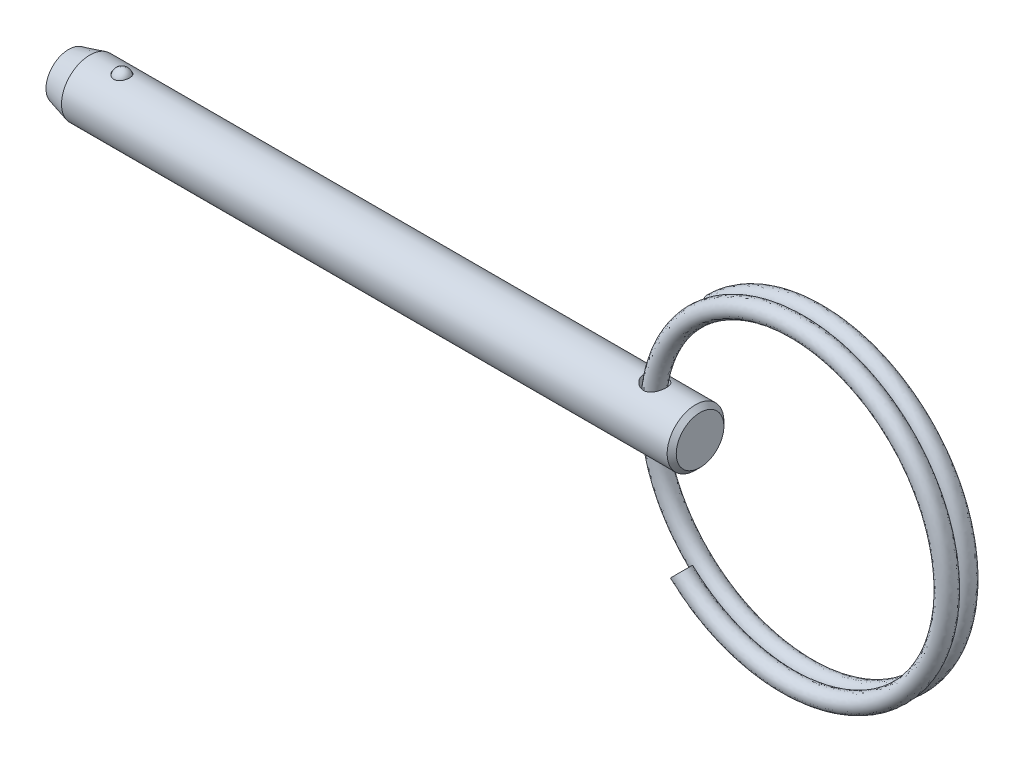
from build123d import *

# Parameters (mm, degrees)
SKETCH4_W          = 0.9525
SKETCH4_H          = 4.7625
SWEEP1_PITCH       = 1.5494
SWEEP1_HEIGHT      = 1.355725
SWEEP1_RADIUS      = 13.462
SKETCH6_R          = 0.762
SWEEP2_PITCH       = 1.5494
SWEEP2_HEIGHT      = 1.355725
SWEEP2_RADIUS      = 13.462
SWEEP2_START_ANGLE = -180
SKETCH6_2_R        = 0.762


with BuildPart() as part:
    # Sketch1 → Revolve1 (revolve)
    with BuildSketch(Plane.XY, mode=Mode.PRIVATE) as revolve1_sk:
        Polygon((26.5049, 2.00025), (26.1239, 2.38125), (-24.727510803, 2.38125), (-26.5049, 1.905), (-26.5049, 0), (26.5049, 0), align=None)
    revolve(revolve1_sk.sketch.rotate(Axis((26.5049, 0, 0), (1, 0, 0)), 180), axis=Axis((26.5049, 0, 0), (1, 0, 0)))

    # Sketch2 → Cut-Revolve1 (revolve, cut)
    with BuildSketch(Plane.XY):
        with BuildLine():
            Line((-21.354844331, 2.143125), (-22.720094331, 2.143125))
            ThreePointArc((-22.720094331, 2.143125), (-22.037469331, 2.82575), (-21.354844331, 2.143125))
        make_face()
    revolve(axis=Axis((-21.354844331, 2.143125, 0), (1, 0, 0)), mode=Mode.SUBTRACT)

    # Sketch4 → Cut-Revolve2 (revolve, cut)
    with BuildSketch(Plane.XY, mode=Mode.PRIVATE) as cut_revolve2_sk:
        with Locations((23.18385, 0)):
            Rectangle(SKETCH4_W, SKETCH4_H)
    revolve(cut_revolve2_sk.sketch.rotate(Axis((22.7076, -2.38125, 0), (0, 1, 0)), 180), axis=Axis((22.7076, -2.38125, 0), (0, 1, 0)), mode=Mode.SUBTRACT)


with BuildPart() as body_2:
    # Sketch3 → Revolve2 (revolve)
    with BuildSketch(Plane.XY):
        with BuildLine():
            Line((-21.380244331, 2.143125), (-22.694694331, 2.143125))
            ThreePointArc((-22.694694331, 2.143125), (-22.037469331, 2.80035), (-21.380244331, 2.143125))
        make_face()
    revolve(axis=Axis((-21.380244331, 2.143125, 0), (1, 0, 0)))


with BuildPart() as body_3:
    # Sweep1: sweep along a helix
    with BuildLine() as sweep1_path:
        Helix(SWEEP1_PITCH, SWEEP1_HEIGHT, SWEEP1_RADIUS, center=(35.287648906, 0, 0), direction=(0, 0, -1), lefthand=True)
    # Sketch6 → Sweep1 (sweep)
    with BuildSketch(Plane(origin=(114.003847968, 0, 0), x_dir=(0, 0, -1), z_dir=(0, 1, 0))):
        with Locations((0, 91.416199061)):
            Circle(SKETCH6_R)
    sweep(path=sweep1_path.line, is_frenet=True)

    # Sweep2: sweep along a helix
    with BuildLine() as sweep2_path:
        add(Helix(SWEEP2_PITCH, SWEEP2_HEIGHT, SWEEP2_RADIUS, center=(35.287648906, 0, 0), direction=(0, 0, 1), lefthand=True, mode=Mode.PRIVATE).rotate(Axis((35.287648906, 0, 0), (0, 0, 1)), SWEEP2_START_ANGLE))
    # Sketch6<2> → Sweep2 (sweep)
    with BuildSketch(Plane(origin=(114.003847968, 0, 0), x_dir=(0, 0, -1), z_dir=(0, 1, 0))):
        with Locations((0, 91.416199061)):
            Circle(SKETCH6_2_R)
    sweep(path=sweep2_path.line, is_frenet=True)


solid = Compound([part.part, body_2.part, body_3.part])
